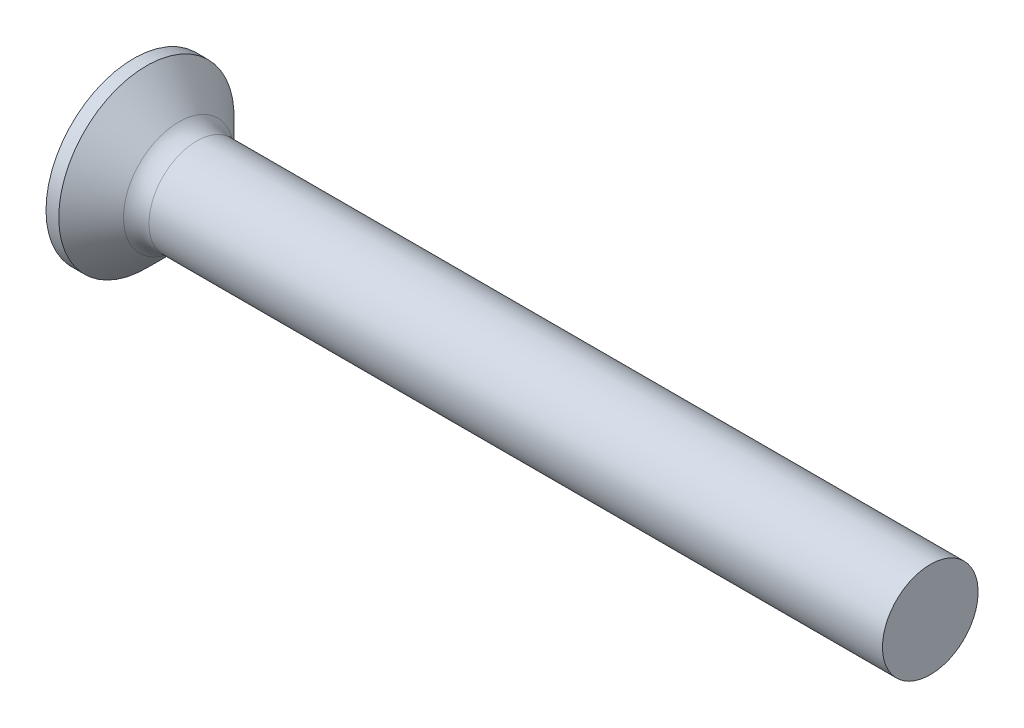
from build123d import *

# Parameters (mm, degrees)
FILLET1_R    = 0.8
RECPAT_COUNT = 2
RECPAT_ANGLE = 90


with BuildPart() as part:
    # BodySke → Base-Revolve (revolve)
    with BuildSketch(Plane.XY, mode=Mode.PRIVATE) as base_revolve_sk:
        Polygon((0, 0), (0, 2.75), (0.4, 2.75), (1.65, 1.5), (25, 1.5), (25, 0), align=None)
    revolve(base_revolve_sk.sketch.rotate(Axis((-6.35, 0, 0), (1, 0, 0)), 90), axis=Axis((-6.35, 0, 0), (1, 0, 0)))

    # Fillet1
    fillet1_edges = [part.edges().sort_by_distance(p)[0] for p in [
        (1.65, 0, -1.5),
    ]]
    fillet(fillet1_edges, radius=FILLET1_R)

    # Sketch3 → Recess section 0
    with BuildSketch(Plane.ZY):
        with BuildLine():
            Line((-0.37, 1.5), (0.37, 1.5))
            Line((0.37, 1.5), (0.37, -1.5))
            Line((0.37, -1.5), (-0.37, -1.5))
            Line((-0.37, -1.5), (-0.37, 1.5))
        make_face()
    # Sketch4 → Recess section 1
    with BuildSketch(Plane.ZY.offset(-2.01)):
        with BuildLine():
            Line((-0.37, 0.497851135), (0.37, 0.497851135))
            Line((0.37, 0.497851135), (0.37, -0.497851135))
            Line((0.37, -0.497851135), (-0.37, -0.497851135))
            Line((-0.37, -0.497851135), (-0.37, 0.497851135))
        make_face()
    recess = loft(mode=Mode.SUBTRACT)

    # RecPat: Recess ×2 about axis
    recpat_axis = Axis((0, 0, 0), (1, 0, 0))
    for i in range(1, RECPAT_COUNT):
        add(recess.rotate(recpat_axis, i * RECPAT_ANGLE / (RECPAT_COUNT - 1)), mode=Mode.SUBTRACT)

    # RecCorSke → RecessCore (revolve, cut)
    with BuildSketch(Plane.XY, mode=Mode.PRIVATE) as recesscore_sk:
        Polygon((0, 0), (0, 0.696552892), (2.01, 0.556), (2.190655351, 0), align=None)
    revolve(recesscore_sk.sketch.rotate(Axis((-3.175, 0, 0), (1, 0, 0)), 90), axis=Axis((-3.175, 0, 0), (1, 0, 0)), mode=Mode.SUBTRACT)


solid = part.part
